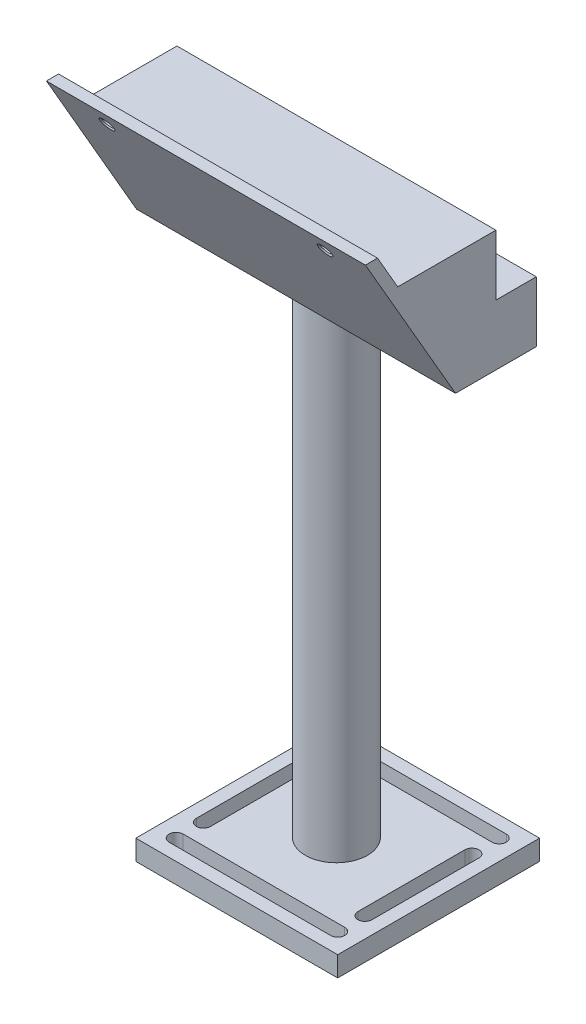
from build123d import *

# Parameters (mm, degrees)
SKETCH_1_W                    = 79
SKETCH_1_H                    = 30
EXTRUDE_2_DEPTH               = 10
SKETCH_9_W                    = 79
SKETCH_9_H                    = 15
EXTRUDE_3_DEPTH               = 10
SKETCH_10_R                   = 7.701725444
EXTRUDE_4_DEPTH               = 120
SKETCH_11_W                   = 50
SKETCH_11_H                   = 50
EXTRUDE_5_DEPTH               = 5
CUT_EXTRUDE_1_DEPTH           = 10
EXTRUDE_6_DEPTH               = 79
EXTRUDE_7_DEPTH               = 79
HOLE_WIZARD_M3_5_1_AT_2_COUNT = 2
HOLE_WIZARD_M3_5_1_AT_2_PITCH = 54


with BuildPart() as part:
    # 草图1 → 凸台-拉伸2 (new body)
    with BuildSketch(Plane.XY):
        with Locations((39.5, 15)):
            Rectangle(SKETCH_1_W, SKETCH_1_H)
    extrude(amount=EXTRUDE_2_DEPTH)

    # 草图9 → 凸台-拉伸3 (add)
    with BuildSketch(Plane(origin=(0, 0, 0), x_dir=(-1, 0, 0), z_dir=(0, 0, -1))):
        with Locations((-39.5, 7.5)):
            Rectangle(SKETCH_9_W, SKETCH_9_H)
    extrude(amount=EXTRUDE_3_DEPTH)

    # 草图10 → 凸台-拉伸4 (add)
    with BuildSketch(Plane.XZ):
        with Locations(Location((39.5, 0, 0), (0, 0, 270))):
            Circle(SKETCH_10_R)
    extrude(amount=EXTRUDE_4_DEPTH)

    # 草图13 → 凸台-拉伸6 (add)
    with BuildSketch(Plane(origin=(79, 0, 0), x_dir=(0, 0, -1), z_dir=(1, 0, 0))):
        Polygon((-10, 0), (-27.320508076, 30), (-10, 30), align=None)
    extrude(amount=-EXTRUDE_6_DEPTH)

    # 草图16 → 凸台-拉伸7 (add)
    with BuildSketch(Plane(origin=(79, 0, 0), x_dir=(0, 0, -1), z_dir=(1, 0, 0))):
        Polygon((-27.320508076, 30), (-32.320508076, 38.660254038), (-29.320508076, 38.660254038), (-24.320508076, 30), align=None)
    extrude(amount=-EXTRUDE_7_DEPTH)

    # 草图18 → M3.5 螺纹孔1 (revolve, cut)
    with BuildSketch(Plane(origin=(12.5, 34.330127019, 29.820508076), x_dir=(0, -0.8660254037844362, -0.5000000000000046), z_dir=(1, 0, 0))):
        Polygon((0, 0), (0, 36.650635095), (1.45, 36.650635095), (1.45, 0.325), (1.775, 0), align=None)
    hole_wizard_m3_5_1 = revolve(axis=Axis((12.5, 31.155127019, 35.31976939), (0, 0.5000000000000046, -0.866025403784436)), mode=Mode.SUBTRACT)

    # M3.5 螺纹孔1 at 2: M3.5 螺纹孔1 ×2
    with Locations(*[(i * HOLE_WIZARD_M3_5_1_AT_2_PITCH, 0, 0) for i in range(1, HOLE_WIZARD_M3_5_1_AT_2_COUNT)]):
        add(hole_wizard_m3_5_1, mode=Mode.SUBTRACT)


with BuildPart() as body_2:
    # 草图11 → 凸台-拉伸5 (new body)
    with BuildSketch(Plane.XZ.offset(120)):
        with Locations((39.813489276, 0)):
            Rectangle(SKETCH_11_W, SKETCH_11_H)
    extrude(amount=EXTRUDE_5_DEPTH)

    # 草图12 → 切除-拉伸1 (cut)
    with BuildSketch(Plane.XZ.offset(125)):
        with BuildLine():
            Line((19.813489276, 21.75), (59.813489276, 21.75))
            ThreePointArc((59.813489276, 21.75), (61.563489276, 20), (59.813489276, 18.25))
            Line((59.813489276, 18.25), (19.813489276, 18.25))
            ThreePointArc((19.813489276, 18.25), (18.063489276, 20), (19.813489276, 21.75))
        make_face()
        with BuildLine():
            Line((19.813489276, -21.75), (59.813489276, -21.75))
            ThreePointArc((59.813489276, -21.75), (61.563489276, -20), (59.813489276, -18.25))
            Line((59.813489276, -18.25), (19.813489276, -18.25))
            ThreePointArc((19.813489276, -18.25), (18.063489276, -20), (19.813489276, -21.75))
        make_face()
        with BuildLine():
            Line((21.563489276, 13.25), (21.563489276, -13.25))
            ThreePointArc((21.563489276, -13.25), (19.813489276, -15), (18.063489276, -13.25))
            Line((18.063489276, -13.25), (18.063489276, 13.25))
            ThreePointArc((18.063489276, 13.25), (19.813489276, 15), (21.563489276, 13.25))
        make_face()
        with BuildLine():
            Line((58.063489276, 13.25), (58.063489276, -13.25))
            ThreePointArc((58.063489276, -13.25), (59.813489276, -15), (61.563489276, -13.25))
            Line((61.563489276, -13.25), (61.563489276, 13.25))
            ThreePointArc((61.563489276, 13.25), (59.813489276, 15), (58.063489276, 13.25))
        make_face()
    extrude(amount=-CUT_EXTRUDE_1_DEPTH, mode=Mode.SUBTRACT)


solid = Compound([part.part, body_2.part])
